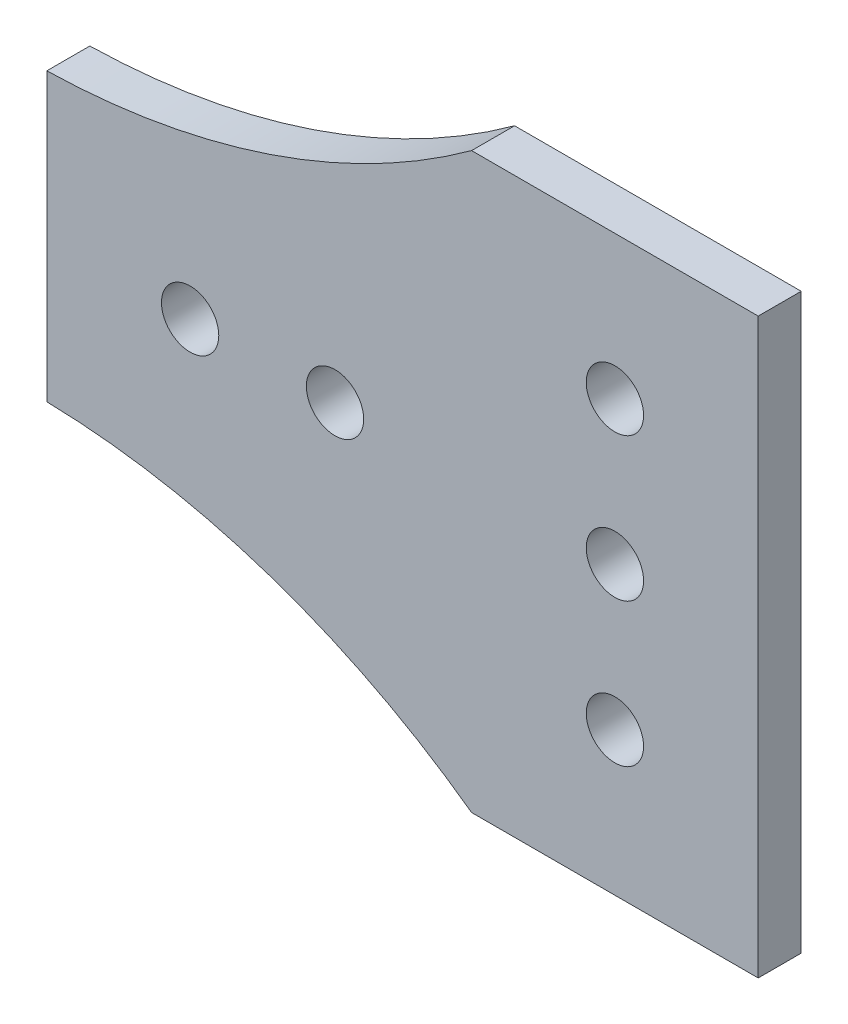
from build123d import *

# Parameters (mm, degrees)
SKETCH_1_R      = 2
EXTRUDE_1_DEPTH = 3


with BuildPart() as part:
    # 草图1 → 凸台-拉伸1 (new body)
    with BuildSketch(Plane.XY):
        with BuildLine():
            Line((-27.342128098, -0.00537982), (-27.342128098, -20.00537982))
            ThreePointArc((-27.342128098, -20.00537982), (-11.758458295, -22.743290911), (2.298888053, -30.00537982))
            Line((2.298888053, -30.00537982), (22.298888053, -30.00537982))
            Line((22.298888053, -30.00537982), (22.298888053, 9.99462018))
            Line((22.298888053, 9.99462018), (2.298888053, 9.99462018))
            ThreePointArc((2.298888053, 9.99462018), (-11.758458295, 2.732531272), (-27.342128098, -0.00537982))
        make_face()
        with Locations((-17.342128098, -10.00537982)):
            Circle(SKETCH_1_R, mode=Mode.SUBTRACT)
        with Locations((-7.231642467, -10.00537982)):
            Circle(SKETCH_1_R, mode=Mode.SUBTRACT)
        with Locations((12.298888053, -10.00537982)):
            Circle(SKETCH_1_R, mode=Mode.SUBTRACT)
        with Locations((12.298888053, -0.00537982)):
            Circle(SKETCH_1_R, mode=Mode.SUBTRACT)
        with Locations((12.298888053, -20.00537982)):
            Circle(SKETCH_1_R, mode=Mode.SUBTRACT)
    extrude(amount=EXTRUDE_1_DEPTH)


solid = part.part
